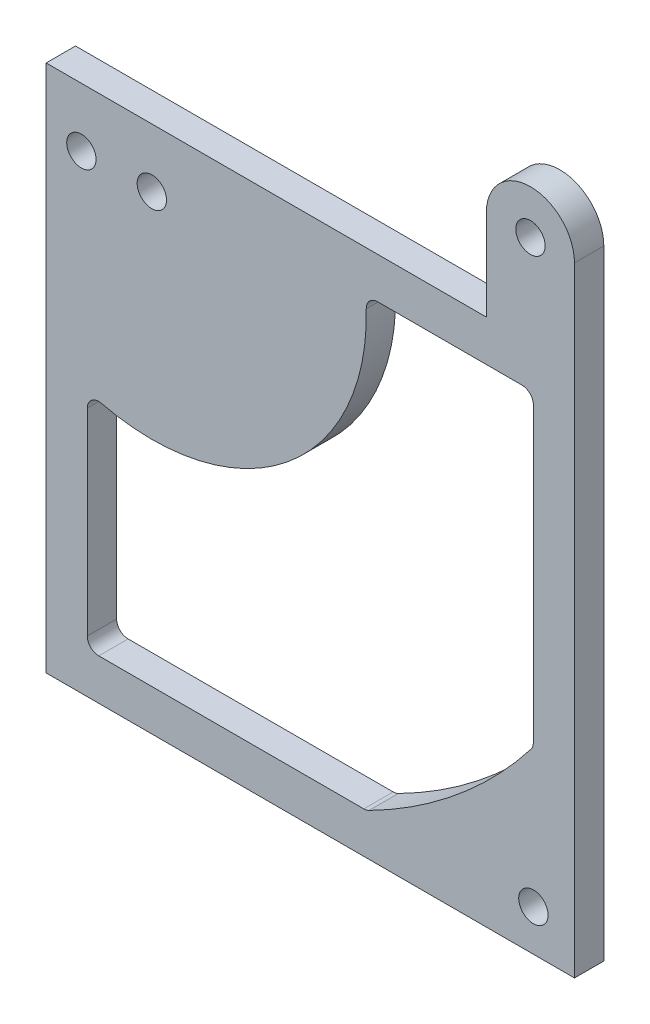
from build123d import *

# Parameters (mm, degrees)
SKETCH1_R           = 3.175
BOSS_EXTRUDE1_DEPTH = 3.175


with BuildPart() as part:
    # Sketch1 → Boss-Extrude1 (new, symmetric)
    with BuildSketch(Plane.XY):
        with BuildLine():
            Line((-57.15, -57.15), (57.15, -57.15))
            Line((57.15, -57.15), (57.15, 76.835))
            ThreePointArc((57.15, 76.835), (47.625, 86.36), (38.1, 76.835))
            Line((38.1, 76.835), (38.1, 57.15))
            Line((38.1, 57.15), (-57.15, 57.15))
            Line((-57.15, 57.15), (-57.15, -57.15))
        make_face()
        with Locations((-49.53, 44.45)):
            Circle(SKETCH1_R, mode=Mode.SUBTRACT)
        with Locations((-34.29, 44.45)):
            Circle(SKETCH1_R, mode=Mode.SUBTRACT)
        with Locations((48.26, -48.25058611)):
            Circle(SKETCH1_R, mode=Mode.SUBTRACT)
        with Locations((47.625, 76.835)):
            Circle(SKETCH1_R, mode=Mode.SUBTRACT)
        with BuildLine():
            Line((-45.77152391, -48.25058611), (11.571822448, -48.25058611))
            ThreePointArc((11.571822448, -48.25058611), (12.151642643, -48.182093861), (12.69954516, -47.980387445))
            ThreePointArc((12.69954516, -47.980387445), (31.830233088, -35.421826409), (47.740202739, -18.972706629))
            ThreePointArc((47.740202739, -18.972706629), (48.126468012, -18.254805898), (48.26, -17.450597264))
            Line((48.26, -17.450597264), (48.26, 45.77152391))
            ThreePointArc((48.26, 45.77152391), (47.531142228, 47.531142228), (45.77152391, 48.26))
            Line((45.77152391, 48.26), (14.585930721, 48.26))
            ThreePointArc((14.585930721, 48.26), (12.802691065, 47.50719945), (12.09836376, 45.704264235))
            ThreePointArc((12.09836376, 45.704264235), (-5.096432418, 8.378001401), (-45.187165534, -0.657707262))
            ThreePointArc((-45.187165534, -0.657707262), (-47.310736599, -1.121263606), (-48.26, -3.076599268))
            Line((-48.26, -3.076599268), (-48.26, -45.76211002))
            ThreePointArc((-48.26, -45.76211002), (-47.531142228, -47.521728338), (-45.77152391, -48.25058611))
        make_face(mode=Mode.SUBTRACT)
    extrude(amount=BOSS_EXTRUDE1_DEPTH, both=True)


solid = part.part
